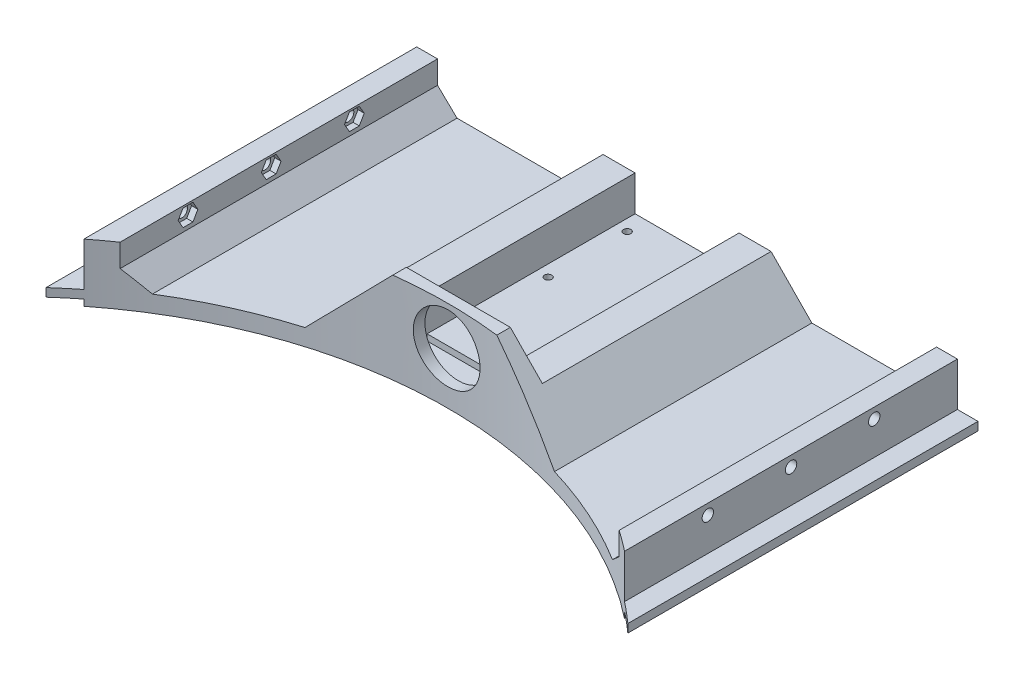
from build123d import *

# Parameters (mm, degrees)
SKETCH1_W               = 650
SKETCH1_H               = 650
BOSS_EXTRUDE1_DEPTH     = 8
BOSS_EXTRUDE2_DEPTH     = 650
CUT_EXTRUDE2_DEPTH      = 921.277302922
CUT_EXTRUDE2_DEPTH_BACK = 921.277302922
SKETCH4_R               = 16.05
CUT_EXTRUDE1_DEPTH      = 920.932062709
CUT_EXTRUDE1_DEPTH_BACK = 920.932062709
SKETCH2_R               = 210
CUT_EXTRUDE3_DEPTH      = 921.277302998
CUT_EXTRUDE3_DEPTH_BACK = 110
CUT_EXTRUDE4_DEPTH      = 110
CUT_EXTRUDE5_DEPTH      = 920.932062713
CUT_EXTRUDE5_DEPTH_BACK = 920.932062713
SKETCH7_OUTSIDE_W       = 836.056
SKETCH7_OUTSIDE_H       = 836.056
SKETCH7_OUTSIDE_W_2     = 260
SKETCH7_OUTSIDE_H_2     = 231.544504505
BOSS_EXTRUDE3_DEPTH     = 170
SKETCH9_W               = 9.9
SKETCH9_H               = 4
BOSS_EXTRUDE4_DEPTH     = 170
CUT_EXTRUDE6_DEPTH      = 800.941879143
CUT_EXTRUDE6_DEPTH_BACK = 800.941879143
SKETCH10_R              = 210
SKETCH11_W              = 50
SKETCH11_H              = 3
BOSS_EXTRUDE5_DEPTH     = 100
CUT_EXTRUDE7_DEPTH      = 800.81358281
CUT_EXTRUDE7_DEPTH_BACK = 800.81358281
SKETCH12_R              = 1.75
CUT_EXTRUDE8_DEPTH      = 706.164040729
CUT_EXTRUDE8_DEPTH_BACK = 10
SKETCH13_R              = 2.75
CUT_EXTRUDE9_START      = -10
SKETCH14_R              = 2.75
CUT_EXTRUDE9_DEPTH      = 10
CUT_EXTRUDE10_DEPTH     = 3
LPATTERN1_COUNT         = 3
LPATTERN1_PITCH         = 40
CUT_EXTRUDE11_DEPTH     = 3
LPATTERN2_COUNT         = 3
LPATTERN2_PITCH         = 40
SKETCH17_W              = 15.1
SKETCH17_H              = 100.1
CUT_EXTRUDE12_DEPTH     = 3


with BuildPart() as part:
    # Sketch1 → Boss-Extrude1 (new body)
    with BuildSketch(Plane(origin=(0, 0, 0), x_dir=(1, 0, 0), z_dir=(0, 1, 0))):
        with Locations((325, 325)):
            Rectangle(SKETCH1_W, SKETCH1_H)
    extrude(amount=BOSS_EXTRUDE1_DEPTH)

    # Sketch3 → Boss-Extrude2 (add)
    with BuildSketch(Plane.XY):
        Polygon((300, 43.707142143), (350, 43.707142143), (385, 8), (265, 8), align=None)
    extrude(amount=-BOSS_EXTRUDE2_DEPTH)

    # Sketch4 → Cut-Extrude2 (cut, two sides: drawn at the far end of the back side and taken through both)
    with BuildSketch(Plane.XY.offset(-CUT_EXTRUDE2_DEPTH_BACK)):
        with Locations((325, 25)):
            Circle(SKETCH4_R)
    extrude(amount=CUT_EXTRUDE2_DEPTH + CUT_EXTRUDE2_DEPTH_BACK, mode=Mode.SUBTRACT)

    # Sketch2 → Cut-Extrude1 (cut, two sides: drawn at the far end of the back side and taken through both)
    with BuildSketch(Plane(origin=(0, 8, 0), x_dir=(1, 0, 0), z_dir=(0, 1, 0)).offset(-CUT_EXTRUDE1_DEPTH_BACK)):
        with Locations(Location((325, 325, 0), (0, 0, 270))):
            Circle(SKETCH2_R)
    extrude(amount=CUT_EXTRUDE1_DEPTH + CUT_EXTRUDE1_DEPTH_BACK, mode=Mode.SUBTRACT)

    # Sketch5 → Cut-Extrude3 (cut, two sides: drawn at the far end of the back side and taken through both)
    with BuildSketch(Plane.XY.offset(-CUT_EXTRUDE3_DEPTH_BACK)):
        Polygon((300, 43.707142143), (350, 43.707142143), (365.396078824, 28), (350, 28), (350, 8), (300, 8), (300, 28), (284.603921176, 28), align=None)
    extrude(amount=CUT_EXTRUDE3_DEPTH + CUT_EXTRUDE3_DEPTH_BACK, mode=Mode.SUBTRACT)

    # Sketch6 → Cut-Extrude4 (cut)
    with BuildSketch(Plane(origin=(0, 0, -650), x_dir=(-1, 0, 0), z_dir=(0, 0, -1))):
        Polygon((-350, 43.707142143), (-300, 43.707142143), (-284.603921176, 28), (-300, 28), (-300, 8), (-350, 8), (-350, 28), (-365.396078824, 28), align=None)
    extrude(amount=-CUT_EXTRUDE4_DEPTH, mode=Mode.SUBTRACT)

    # Sketch7 outside → Cut-Extrude5 (cut, two sides: drawn at the far end of the back side and taken through both)
    with BuildSketch(Plane(origin=(0, 8, 0), x_dir=(1, 0, 0), z_dir=(0, 1, 0)).offset(-CUT_EXTRUDE5_DEPTH_BACK)):
        with Locations((325, 325)):
            Rectangle(SKETCH7_OUTSIDE_W, SKETCH7_OUTSIDE_H)
        with Locations((325, 570.772252253)):
            Rectangle(SKETCH7_OUTSIDE_W_2, SKETCH7_OUTSIDE_H_2, mode=Mode.SUBTRACT)
    extrude(amount=CUT_EXTRUDE5_DEPTH + CUT_EXTRUDE5_DEPTH_BACK, mode=Mode.SUBTRACT)

    # Sketch8 → Boss-Extrude3 (add)
    with BuildSketch(Plane(origin=(0, 0, -650), x_dir=(-1, 0, 0), z_dir=(0, 0, -1))):
        Polygon((-455, 8), (-455, 28), (-445, 28), (-445, 17), (-435.61916848, 8), align=None)
        Polygon((-195, 8), (-195, 28), (-205, 28), (-205, 17), (-214.38083152, 8), align=None)
    extrude(amount=-BOSS_EXTRUDE3_DEPTH)

    # Sketch9 → Boss-Extrude4 (add)
    with BuildSketch(Plane(origin=(0, 0, -650), x_dir=(-1, 0, 0), z_dir=(0, 0, -1))):
        with Locations((-459.95, 5)):
            Rectangle(SKETCH9_W, SKETCH9_H)
        with Locations((-190.05, 5)):
            Rectangle(SKETCH9_W, SKETCH9_H)
    extrude(amount=-BOSS_EXTRUDE4_DEPTH)

    # Sketch10 → Cut-Extrude6 (cut, two sides: drawn at the far end of the back side and taken through both)
    with BuildSketch(Plane(origin=(0, 8, 0), x_dir=(1, 0, 0), z_dir=(0, 1, 0)).offset(-CUT_EXTRUDE6_DEPTH_BACK)):
        with Locations((325, 325)):
            Circle(SKETCH10_R)
    extrude(amount=CUT_EXTRUDE6_DEPTH + CUT_EXTRUDE6_DEPTH_BACK, mode=Mode.SUBTRACT)

    # Sketch11 → Boss-Extrude5 (add)
    with BuildSketch(Plane(origin=(0, 0, -650), x_dir=(-1, 0, 0), z_dir=(0, 0, -1))):
        with Locations((-325, 9.5)):
            Rectangle(SKETCH11_W, SKETCH11_H)
    extrude(amount=-BOSS_EXTRUDE5_DEPTH)

    # Sketch12 → Cut-Extrude7 (cut, two sides: drawn at the far end of the back side and taken through both)
    with BuildSketch(Plane(origin=(0, 11, 0), x_dir=(1, 0, 0), z_dir=(0, 1, 0)).offset(-CUT_EXTRUDE7_DEPTH_BACK)):
        with Locations(Location((305.5, 640.7, 0), (0, 0, 270))):
            Circle(SKETCH12_R)
        with Locations(Location((344.5, 640.7, 0), (0, 0, 270))):
            Circle(SKETCH12_R)
        with Locations(Location((344.5, 602.7, 0), (0, 0, 270))):
            Circle(SKETCH12_R)
        with Locations(Location((305.5, 602.7, 0), (0, 0, 270))):
            Circle(SKETCH12_R)
    extrude(amount=CUT_EXTRUDE7_DEPTH + CUT_EXTRUDE7_DEPTH_BACK, mode=Mode.SUBTRACT)

    # Sketch13 → Cut-Extrude8 (cut, two sides: drawn at the far end of the back side and taken through both)
    with BuildSketch(Plane(origin=(455, 0, 0), x_dir=(0, 0, -1), z_dir=(1, 0, 0)).offset(-CUT_EXTRUDE8_DEPTH_BACK)):
        with Locations((610, 23)):
            Circle(SKETCH13_R)
        with Locations((570, 23)):
            Circle(SKETCH13_R)
        with Locations((530, 23)):
            Circle(SKETCH13_R)
    extrude(amount=CUT_EXTRUDE8_DEPTH + CUT_EXTRUDE8_DEPTH_BACK, mode=Mode.SUBTRACT)

    # Sketch14 → Cut-Extrude9 (cut)
    with BuildSketch(Plane.ZY.offset(-195).offset(CUT_EXTRUDE9_START)):
        with Locations(Location((-610, 23, 0), (0, 0, 180))):
            Circle(SKETCH14_R)
        with Locations(Location((-570, 23, 0), (0, 0, 180))):
            Circle(SKETCH14_R)
        with Locations(Location((-530, 23, 0), (0, 0, 180))):
            Circle(SKETCH14_R)
    extrude(amount=CUT_EXTRUDE9_DEPTH, mode=Mode.SUBTRACT)

    # Sketch15 → Cut-Extrude10 (cut)
    with BuildSketch(Plane(origin=(205, 0, 0), x_dir=(0, 0, -1), z_dir=(1, 0, 0))):
        Polygon((530, 27.1), (527.63, 27.1), (525.262863896, 23), (527.63, 18.9), (530, 18.9), (532.37, 18.9), (534.737136104, 23), (532.37, 27.1), align=None)
    cut_extrude10 = extrude(amount=-CUT_EXTRUDE10_DEPTH, mode=Mode.SUBTRACT)

    # LPattern1: Cut-Extrude10 ×3
    with Locations(*[(0, 0, -i * LPATTERN1_PITCH) for i in range(1, LPATTERN1_COUNT)]):
        add(cut_extrude10, mode=Mode.SUBTRACT)

    # Sketch16 → Cut-Extrude11 (cut)
    with BuildSketch(Plane.ZY.offset(-445)):
        Polygon((-610, 27.1), (-607.63, 27.1), (-605.262863896, 23), (-607.63, 18.9), (-610, 18.9), (-612.37, 18.9), (-614.737136104, 23), (-612.37, 27.1), align=None)
    cut_extrude11 = extrude(amount=-CUT_EXTRUDE11_DEPTH, mode=Mode.SUBTRACT)

    # LPattern2: Cut-Extrude11 ×3
    with Locations(*[(0, 0, i * LPATTERN2_PITCH) for i in range(1, LPATTERN2_COUNT)]):
        add(cut_extrude11, mode=Mode.SUBTRACT)

    # Sketch17 → Cut-Extrude12 (cut)
    with BuildSketch(Plane(origin=(0, 0, 0), x_dir=(-1, 0, 0), z_dir=(0, -1, 0))):
        with Locations((-325.05, 589.95)):
            Rectangle(SKETCH17_W, SKETCH17_H)
    extrude(amount=-CUT_EXTRUDE12_DEPTH, mode=Mode.SUBTRACT)


solid = part.part
